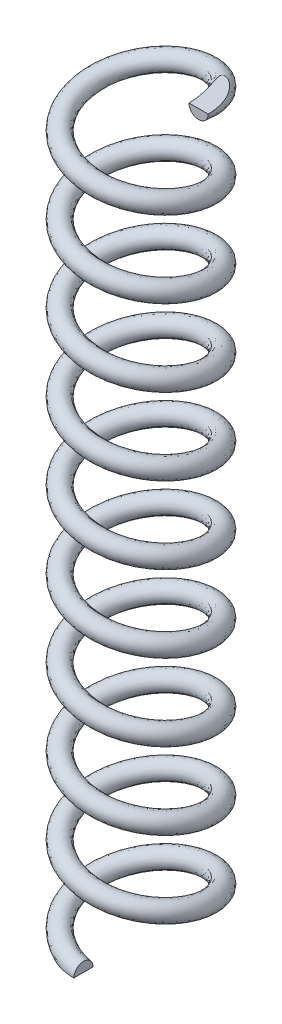
from build123d import *

# Parameters (mm, degrees)
SWEEP1_PITCH            = 20
SWEEP1_HEIGHT           = 195
SWEEP1_RADIUS           = 15
SKETCH2_R               = 2.5
CUT_EXTRUDE1_DEPTH      = 200.04459446
CUT_EXTRUDE1_DEPTH_BACK = 200.04459446
SKETCH3_W               = 258.541203293
SKETCH3_H               = 47.62521531
SKETCH3_W_2             = 114.875828846
SKETCH3_H_2             = 35.364068607


with BuildPart() as part:
    # Sweep1: sweep along a helix
    with BuildLine() as sweep1_path:
        Helix(SWEEP1_PITCH, SWEEP1_HEIGHT, SWEEP1_RADIUS, center=(0, 0, 0), direction=(0, 1, 0), lefthand=True)
    # Sketch2 → Sweep1 (sweep)
    with BuildSketch(Plane(origin=(0, 0, 0), x_dir=(0, 0, -1), z_dir=(1, 0, 0))):
        with Locations((-15, 0)):
            Circle(SKETCH2_R)
    sweep(path=sweep1_path.line, is_frenet=True)

    # Sketch3 → Cut-Extrude1 (cut, two sides: drawn at the far end of the back side and taken through both)
    with BuildSketch(Plane.XY.offset(-CUT_EXTRUDE1_DEPTH_BACK)):
        with Locations((29.030906091, 218.812607655)):
            Rectangle(SKETCH3_W, SKETCH3_H)
        with Locations((-19.626569623, -17.682034304)):
            Rectangle(SKETCH3_W_2, SKETCH3_H_2)
    extrude(amount=CUT_EXTRUDE1_DEPTH + CUT_EXTRUDE1_DEPTH_BACK, mode=Mode.SUBTRACT)


solid = part.part
